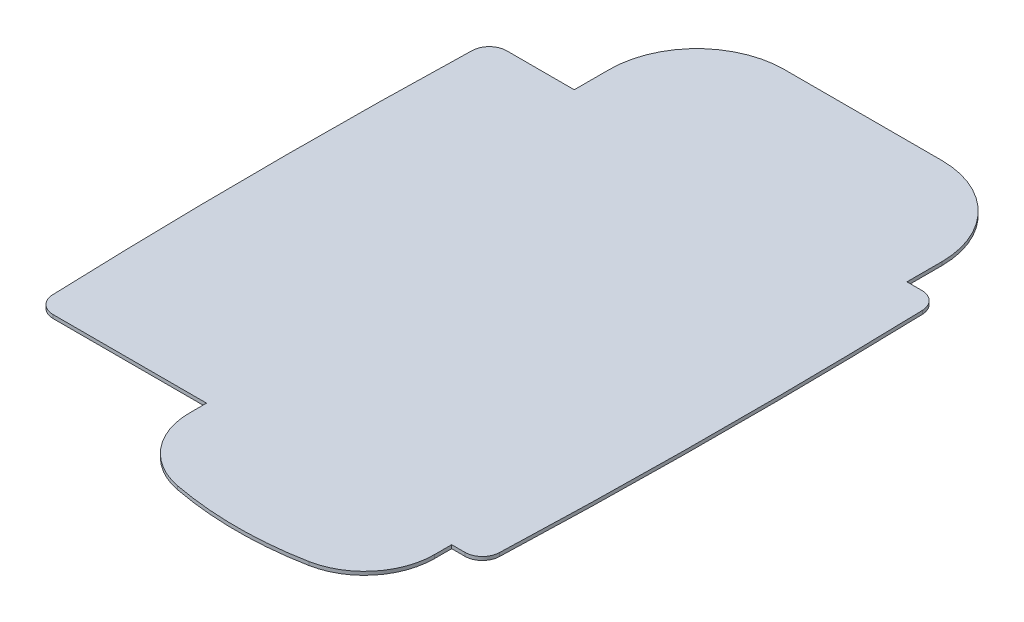
from build123d import *

# Parameters (mm, degrees)
EXTRUDE_1_DEPTH     = 0.5
SKETCH_3_W          = 25
SKETCH_3_H          = 35
CUT_EXTRUDE_1_DEPTH = 114.058613257
SKETCH_4_W          = 10
SKETCH_4_H          = 35
CUT_EXTRUDE_2_DEPTH = 114.058613257
SKETCH_5_W          = 50
SKETCH_5_H          = 20
CUT_EXTRUDE_3_DEPTH = 114.058613257
SKETCH_6_W          = 10
SKETCH_6_H          = 20
CUT_EXTRUDE_4_DEPTH = 114.058613257
EXTRUDE_2_DEPTH     = 0.5
CUT_EXTRUDE_5_DEPTH = 119.289418767
FILLET_1_R          = 5
FILLET_2_R          = 20


with BuildPart() as part:
    # ｽｹｯﾁ1 → ﾎﾞｽ - 押し出し1 (new, symmetric)
    with BuildSketch(Plane(origin=(0, 0, 0), x_dir=(1, 0, 0), z_dir=(0, 1, 0))):
        with BuildLine():
            Line((62.68888804, 92.5), (-62.68888804, 92.5))
            add(Edge.make_bspline(
                [(-62.68888804, 92.5), (-67.396314277, 0), (-62.68888804, -92.5)],
                knots=[4.444925752, 4.444925752, 4.444925752, 4.979852209, 4.979852209, 4.979852209], degree=2, weights=[1, 0.964444431, 1]))
            Line((-62.68888804, -92.5), (62.68888804, -92.5))
            add(Edge.make_bspline(
                [(62.68888804, -92.5), (67.396314277, 0), (62.68888804, 92.5)],
                knots=[1.303333099, 1.303333099, 1.303333099, 1.838259555, 1.838259555, 1.838259555], degree=2, weights=[1, 0.964444431, 1]))
        make_face()
    extrude(amount=EXTRUDE_1_DEPTH, both=True)

    # ｽｹｯﾁ3 → ｶｯﾄ - 押し出し1 (cut, through all)
    with BuildSketch(Plane(origin=(0, 0.5, 0), x_dir=(1, 0, 0), z_dir=(0, 1, 0))):
        with Locations((-52.5, 75)):
            Rectangle(SKETCH_3_W, SKETCH_3_H)
    extrude(amount=-CUT_EXTRUDE_1_DEPTH, mode=Mode.SUBTRACT)

    # ｽｹｯﾁ4 → ｶｯﾄ - 押し出し2 (cut, through all)
    with BuildSketch(Plane(origin=(0, 0.5, 0), x_dir=(1, 0, 0), z_dir=(0, 1, 0))):
        with Locations((60, 75)):
            Rectangle(SKETCH_4_W, SKETCH_4_H)
    extrude(amount=-CUT_EXTRUDE_2_DEPTH, mode=Mode.SUBTRACT)

    # ｽｹｯﾁ5 → ｶｯﾄ - 押し出し3 (cut, through all)
    with BuildSketch(Plane(origin=(0, 0.5, 0), x_dir=(1, 0, 0), z_dir=(0, 1, 0))):
        with Locations((-40, -82.5)):
            Rectangle(SKETCH_5_W, SKETCH_5_H)
    extrude(amount=-CUT_EXTRUDE_3_DEPTH, mode=Mode.SUBTRACT)

    # ｽｹｯﾁ6 → ｶｯﾄ - 押し出し4 (cut, through all)
    with BuildSketch(Plane(origin=(0, 0.5, 0), x_dir=(1, 0, 0), z_dir=(0, 1, 0))):
        with Locations((60, -82.5)):
            Rectangle(SKETCH_6_W, SKETCH_6_H)
    extrude(amount=-CUT_EXTRUDE_4_DEPTH, mode=Mode.SUBTRACT)

    # ｽｹｯﾁ7 → ﾎﾞｽ - 押し出し2 (add, symmetric)
    with BuildSketch(Plane(origin=(0, 0, 0), x_dir=(1, 0, 0), z_dir=(0, 1, 0))):
        with BuildLine():
            Line((-15, -92.5), (55, -92.5))
            ThreePointArc((55, -92.5), (20, -98.825030024), (-15, -92.5))
        make_face()
    extrude(amount=EXTRUDE_2_DEPTH, both=True)

    # ｽｹｯﾁ8 → ｶｯﾄ - 押し出し5 (cut, through all)
    with BuildSketch(Plane(origin=(0, 0.5, 0), x_dir=(1, 0, 0), z_dir=(0, 1, 0))):
        with BuildLine():
            ThreePointArc((-40, 67.5), (-32.677669545, 85.177669514), (-15.000000044, 92.5))
            Line((-15.000000044, 92.5), (-40, 92.5))
            Line((-40, 92.5), (-40, 67.5))
        make_face()
        with BuildLine():
            Line((55, 67.5), (55, 92.5))
            Line((55, 92.5), (30, 92.5))
            ThreePointArc((30, 92.5), (47.67766953, 85.17766953), (55, 67.5))
        make_face()
    extrude(amount=-CUT_EXTRUDE_5_DEPTH, mode=Mode.SUBTRACT)

    # ﾌｨﾚｯﾄ1
    fillet_1_edges = [part.edges().sort_by_distance(p)[0] for p in [
        (-64.116831739, -0.25, -57.5),
        (-63.590195865, -0.25, 72.5),
        (63.590195865, -0.2499997, 72.5),
        (64.116831739, -0.25, -57.5),
    ]]
    fillet(fillet_1_edges, radius=FILLET_1_R)

    # ﾌｨﾚｯﾄ2
    fillet_2_edges = [part.edges().sort_by_distance(p)[0] for p in [
        (-15, 0, 92.5),
        (55, 0, 92.5),
    ]]
    fillet(fillet_2_edges, radius=FILLET_2_R)


solid = part.part
